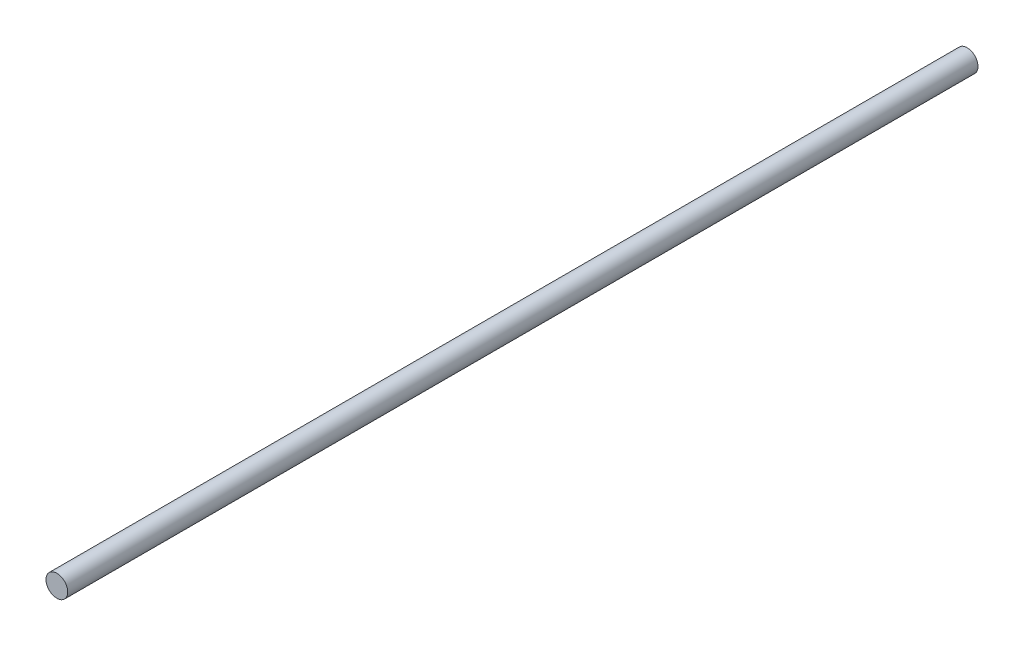
from build123d import *

# Parameters (mm, degrees)
SKETCH1_R           = 4
BOSS_EXTRUDE1_DEPTH = 335


with BuildPart() as part:
    # Sketch1 → Boss-Extrude1 (new body)
    with BuildSketch(Plane.XY):
        Circle(SKETCH1_R)
    extrude(amount=BOSS_EXTRUDE1_DEPTH)


solid = part.part
